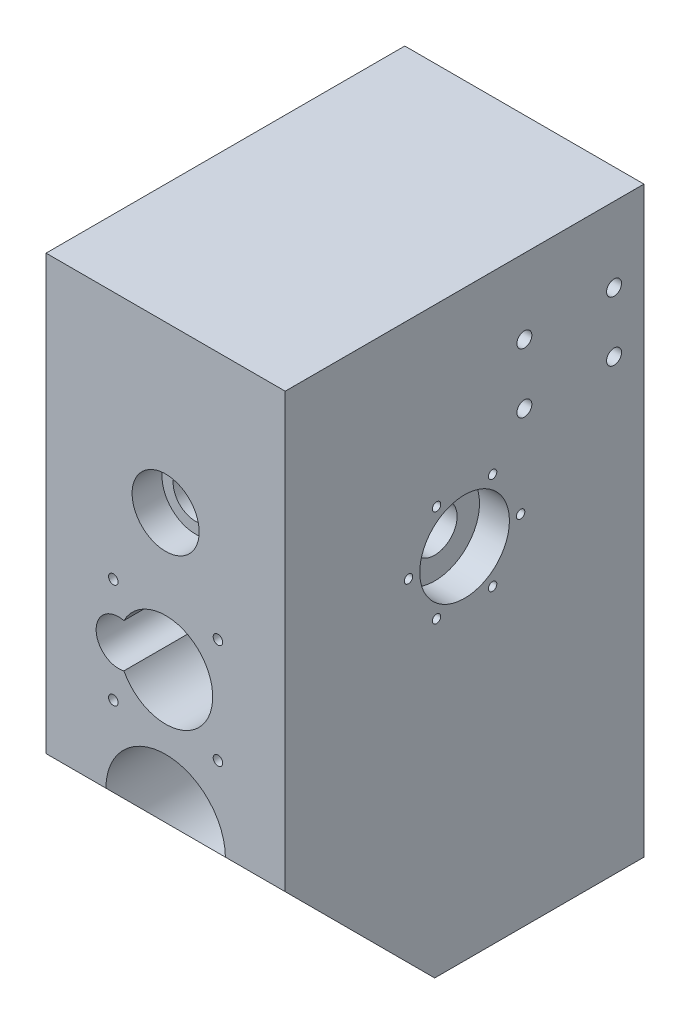
from build123d import *

# Parameters (mm, degrees)
SKETCH1_W           = 101.6
SKETCH1_H           = 247.65
BOSS_EXTRUDE1_DEPTH = 152.4
SKETCH2_R           = 15.08125
SKETCH2_R_2         = 9.525
CUT_EXTRUDE1_DEPTH  = 203.827588422
CUT_EXTRUDE2_DEPTH  = 222.090367554
SKETCH33_R          = 2.5796875
CUT_EXTRUDE33_DEPTH = 25.4
SKETCH53_R          = 31.75
CUT_EXTRUDE37_DEPTH = 24.13
SKETCH54_R          = 19.05
CUT_EXTRUDE38_DEPTH = 38.1
SKETCH4_R           = 19.05
CUT_EXTRUDE40_DEPTH = 12.7
SKETCH55_R          = 1.7859375
CUT_EXTRUDE41_DEPTH = 25.4
SKETCH56_R          = 14.2494
CUT_EXTRUDE42_DEPTH = 12.7
CUT_EXTRUDE43_START = -12.7
SKETCH57_R          = 14.2494
CUT_EXTRUDE43_DEPTH = 12.7
SKETCH58_R          = 25.4
CUT_EXTRUDE44_DEPTH = 50.8
CUT_EXTRUDE45_DEPTH = 127
FILLET2_R           = 0.00254
CUT_EXTRUDE46_START = -12.7
SKETCH60_R          = 19.05
CUT_EXTRUDE46_DEPTH = 12.7
SKETCH61_R          = 9.525
CUT_EXTRUDE47_DEPTH = 222.090367554
SKETCH62_R          = 2.0193
CUT_EXTRUDE48_DEPTH = 25.4
SKETCH63_R          = 3.175
CUT_EXTRUDE49_DEPTH = 12.7


with BuildPart() as part:
    # Sketch1 → Boss-Extrude1 (new body)
    with BuildSketch(Plane.XY):
        Rectangle(SKETCH1_W, SKETCH1_H)
    extrude(amount=BOSS_EXTRUDE1_DEPTH)

    # Sketch2 → Cut-Extrude1 (cut, through all)
    with BuildSketch(Plane(origin=(0, 0, 0), x_dir=(-1, 0, 0), z_dir=(0, 0, -1))):
        with Locations((0, -60.579)):
            Circle(SKETCH2_R)
        with Locations((0, 53.721)):
            Circle(SKETCH2_R_2)
    extrude(amount=-CUT_EXTRUDE1_DEPTH, mode=Mode.SUBTRACT)

    # Sketch3 → Cut-Extrude2 (cut, through all)
    with BuildSketch(Plane.ZY.offset(50.8)):
        Polygon((152.4, -60.325), (88.9, -123.825), (152.4, -123.825), align=None)
    extrude(amount=-CUT_EXTRUDE2_DEPTH, mode=Mode.SUBTRACT)

    # Sketch33 → Cut-Extrude33 (cut)
    with BuildSketch(Plane(origin=(0, 0, 0), x_dir=(-1, 0, 0), z_dir=(0, 0, -1))):
        with Locations((-40.005, 102.9335)):
            Circle(SKETCH33_R)
        with Locations((40.005, 102.9335)):
            Circle(SKETCH33_R)
        with Locations((40.005, 4.5085)):
            Circle(SKETCH33_R)
        with Locations((-40.005, 4.5085)):
            Circle(SKETCH33_R)
    extrude(amount=-CUT_EXTRUDE33_DEPTH, mode=Mode.SUBTRACT)

    # Sketch53 → Cut-Extrude37 (cut)
    with BuildSketch(Plane(origin=(0, 0, 0), x_dir=(-1, 0, 0), z_dir=(0, 0, -1))):
        with Locations((0, -60.579)):
            Circle(SKETCH53_R)
    extrude(amount=-CUT_EXTRUDE37_DEPTH, mode=Mode.SUBTRACT)

    # Sketch54 → Cut-Extrude38 (cut)
    with BuildSketch(Plane(origin=(0, 0, 0), x_dir=(-1, 0, 0), z_dir=(0, 0, -1))):
        with Locations((0, 53.721)):
            Circle(SKETCH54_R)
    extrude(amount=-CUT_EXTRUDE38_DEPTH, mode=Mode.SUBTRACT)

    # Sketch4 → Cut-Extrude40 (cut)
    with BuildSketch(Plane(origin=(50.8, 0, 0), x_dir=(0, 0, -1), z_dir=(1, 0, 0))):
        with Locations((-76.2, 28.575)):
            Circle(SKETCH4_R)
    extrude(amount=-CUT_EXTRUDE40_DEPTH, mode=Mode.SUBTRACT)

    # Sketch55 → Cut-Extrude41 (cut)
    with BuildSketch(Plane.ZY.offset(50.8)):
        with Locations((52.3875, 28.575)):
            Circle(SKETCH55_R)
        with Locations((64.29375, 49.197229928)):
            Circle(SKETCH55_R)
        with Locations((88.10625, 49.197229928)):
            Circle(SKETCH55_R)
        with Locations((100.0125, 28.575)):
            Circle(SKETCH55_R)
        with Locations((88.10625, 7.952770072)):
            Circle(SKETCH55_R)
        with Locations((64.29375, 7.952770072)):
            Circle(SKETCH55_R)
    cut_extrude41 = extrude(amount=-CUT_EXTRUDE41_DEPTH, mode=Mode.SUBTRACT)

    # Sketch56 → Cut-Extrude42 (cut)
    with BuildSketch(Plane.XY.offset(152.4)):
        with Locations((0, 53.721)):
            Circle(SKETCH56_R)
    extrude(amount=-CUT_EXTRUDE42_DEPTH, mode=Mode.SUBTRACT)

    # Sketch57 → Cut-Extrude43 (cut)
    with BuildSketch(Plane(origin=(0, 0, 38.1), x_dir=(-1, 0, 0), z_dir=(0, 0, -1)).offset(CUT_EXTRUDE43_START)):
        with Locations(Location((0, 53.721, 0), (0, 0, 180))):
            Circle(SKETCH57_R)
    extrude(amount=CUT_EXTRUDE43_DEPTH, mode=Mode.SUBTRACT)

    # Sketch58 → Cut-Extrude44 (cut)
    with BuildSketch(Plane.XY.offset(152.4)):
        with Locations((0, -60.579)):
            Circle(SKETCH58_R)
    extrude(amount=-CUT_EXTRUDE44_DEPTH, mode=Mode.SUBTRACT)

    # Sketch59 → Cut-Extrude45 (cut)
    with BuildSketch(Plane.XY.offset(152.4)):
        with BuildLine():
            ThreePointArc((-17.734642857, -13.34047826), (20.0025, -4.0894), (-17.734642857, 5.16167826))
            ThreePointArc((-17.734642857, 5.16167826), (-29.5275, -4.0894), (-17.734642857, -13.34047826))
        make_face()
    extrude(amount=-CUT_EXTRUDE45_DEPTH, mode=Mode.SUBTRACT)

    # Fillet2
    fillet2_edges = [part.edges().sort_by_distance(p)[0] for p in [
        (50.8, -123.825, 44.45),
        (-50.8, -123.825, 44.45),
        (-50.8, 123.825, 76.2),
        (50.8, 123.825, 76.2),
    ]]
    fillet(fillet2_edges, radius=FILLET2_R)

    # Sketch60 → Cut-Extrude46 (cut)
    with BuildSketch(Plane.ZY.offset(50.8).offset(CUT_EXTRUDE46_START)):
        with Locations(Location((76.2, 28.575, 0), (0, 0, 180))):
            Circle(SKETCH60_R)
    extrude(amount=CUT_EXTRUDE46_DEPTH, mode=Mode.SUBTRACT)

    # Sketch61 → Cut-Extrude47 (cut, through all)
    with BuildSketch(Plane(origin=(50.8, 0, 0), x_dir=(0, 0, -1), z_dir=(1, 0, 0))):
        with Locations((-76.2, 28.575)):
            Circle(SKETCH61_R)
    extrude(amount=-CUT_EXTRUDE47_DEPTH, mode=Mode.SUBTRACT)

    # Sketch62 → Cut-Extrude48 (cut)
    with BuildSketch(Plane.XY.offset(152.4)):
        with Locations((-22.225, 18.1356)):
            Circle(SKETCH62_R)
        with Locations((22.225, 18.1356)):
            Circle(SKETCH62_R)
        with Locations((22.225, -26.3144)):
            Circle(SKETCH62_R)
        with Locations((-22.225, -26.3144)):
            Circle(SKETCH62_R)
    extrude(amount=-CUT_EXTRUDE48_DEPTH, mode=Mode.SUBTRACT)

    # Sketch63 → Cut-Extrude49 (cut)
    with BuildSketch(Plane(origin=(50.8, 0, 0), x_dir=(0, 0, -1), z_dir=(1, 0, 0))):
        with Locations((-50.8, 66.675)):
            Circle(SKETCH63_R)
        with Locations((-12.7, 66.675)):
            Circle(SKETCH63_R)
        with Locations((-12.7, 92.075)):
            Circle(SKETCH63_R)
        with Locations((-50.8, 92.075)):
            Circle(SKETCH63_R)
    extrude(amount=-CUT_EXTRUDE49_DEPTH, mode=Mode.SUBTRACT)

    # Mirror2: Cut-Extrude41 across plane
    add(cut_extrude41.mirror(Plane(origin=(0, 0, 0), x_dir=(0, 0, 1), z_dir=(1, 0, 0))), mode=Mode.SUBTRACT)


solid = part.part
